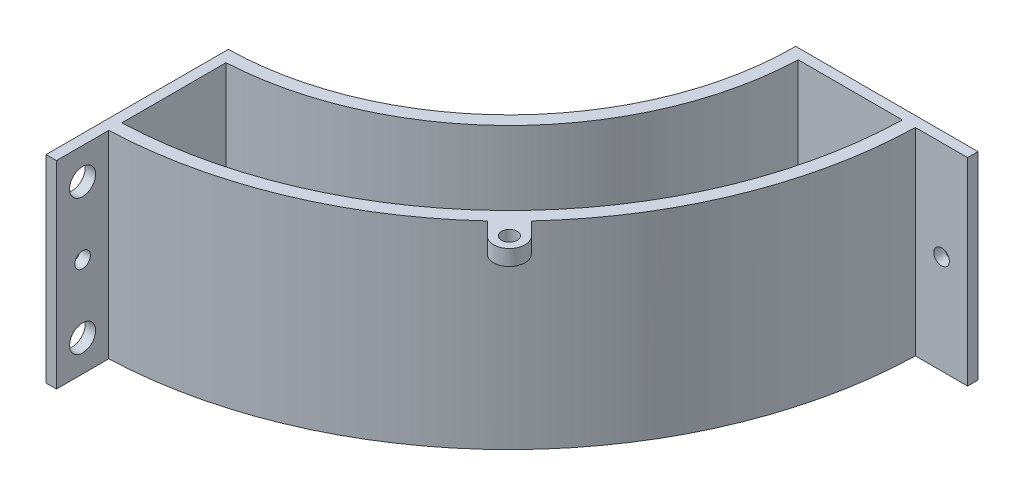
from build123d import *

# Parameters (mm, degrees)
EXTRUDE_1_DEPTH      = 36
EXTRUDE_START        = -2
EXTRUDE_2_DEPTH      = 2
SKETCH_3_R           = 2.5
SKETCH_3_R_2         = 1.5
CUT_EXTRUDE_1_DEPTH  = 126.677663072
EXTRUDE_3_DEPTH      = 2
EXTRUDE_3_DEPTH_BACK = 2
SKETCH_4_R           = 1.5
SKETCH_5_W           = 98.68516208
SKETCH_5_H           = 47.907231557
CUT_EXTRUDE_2_DEPTH  = 133.268193437
SKETCH_6_R           = 1.5
EXTRUDE_4_DEPTH      = 3


with BuildPart() as part:
    # 草图1 → 凸台-拉伸1 (new body)
    with BuildSketch(Plane(origin=(0, 0, 0), x_dir=(1, 0, 0), z_dir=(0, 1, 0))):
        with BuildLine():
            Line((3, -79.943730211), (3, -89.993749756))
            Line((3, -89.993749756), (1, -89.993749756))
            Line((1, -89.993749756), (1, -54.990908339))
            ThreePointArc((1, -54.990908339), (55, 0), (1, 54.990908339))
            Line((1, 54.990908339), (1, 79.993749756))
            Line((1, 79.993749756), (1, 89.993749756))
            Line((1, 89.993749756), (3, 89.993749756))
            Line((3, 89.993749756), (3, 79.943730211))
            ThreePointArc((3, 79.943730211), (80, 0), (3, -79.943730211))
        make_face()
        with BuildLine():
            Line((3, 77.441913716), (3, 57.421685799))
            ThreePointArc((3, 57.421685799), (57.5, 0), (3, -57.421685799))
            Line((3, -57.421685799), (3, -77.441913716))
            ThreePointArc((3, -77.441913716), (77.5, 0), (3, 77.441913716))
        make_face(mode=Mode.SUBTRACT)
    extrude(amount=EXTRUDE_1_DEPTH)

    # 草图2 → 凸台-拉伸2 (add)
    with BuildSketch(Plane(origin=(0, 0, 0), x_dir=(1, 0, 0), z_dir=(0, 1, 0)).offset(EXTRUDE_START)):
        with BuildLine():
            Line((1, 89.993749756), (1, 54.990908339))
            ThreePointArc((1, 54.990908339), (55, 0), (1, -54.990908339))
            Line((1, -54.990908339), (1, -89.993749756))
            Line((1, -89.993749756), (3, -89.993749756))
            Line((3, -89.993749756), (3, -79.943730211))
            ThreePointArc((3, -79.943730211), (80, 0), (3, 79.943730211))
            Line((3, 79.943730211), (3, 89.993749756))
            Line((3, 89.993749756), (1, 89.993749756))
        make_face()
    extrude(amount=EXTRUDE_2_DEPTH)

    # 草图3 → 切除-拉伸1 (cut, through all)
    with BuildSketch(Plane(origin=(0, 0, 0), x_dir=(0, 0, -1), z_dir=(1, 0, 0))):
        with Locations((-84.968739983, 30)):
            Circle(SKETCH_3_R)
        with Locations((-84.968739983, 17)):
            Circle(SKETCH_3_R_2)
        with Locations((84.968739983, 17)):
            Circle(SKETCH_3_R_2)
        with Locations((84.968739983, 30)):
            Circle(SKETCH_3_R)
        with Locations((-84.968739983, 4)):
            Circle(SKETCH_3_R)
    extrude(amount=CUT_EXTRUDE_1_DEPTH, mode=Mode.SUBTRACT)

    # 草图4 → 凸台-拉伸3 (add, two sides: drawn at the far end of the back side and taken through both)
    with BuildSketch(Plane.XY.offset(-EXTRUDE_3_DEPTH_BACK)):
        Polygon((80, 36), (55, 36), (55, -2), (80, -2), (90, -2), (90, 36), align=None)
        with Locations((85, 17)):
            Circle(SKETCH_4_R, mode=Mode.SUBTRACT)
    extrude(amount=EXTRUDE_3_DEPTH + EXTRUDE_3_DEPTH_BACK)

    # 草图5 → 切除-拉伸2 (cut, through all)
    with BuildSketch(Plane.XY):
        with Locations((47.157910723, 20.571893337)):
            Rectangle(SKETCH_5_W, SKETCH_5_H)
    extrude(amount=-CUT_EXTRUDE_2_DEPTH, mode=Mode.SUBTRACT)

    # 草图6 → 凸台-拉伸4 (add)
    with BuildSketch(Plane(origin=(0, 36, 0), x_dir=(1, 0, 0), z_dir=(0, 1, 0))):
        with BuildLine():
            Line((58.650074089, -54.407433402), (54.407433402, -58.650074089))
            Line((54.407433402, -58.650074089), (56.882307136, -61.124947823))
            ThreePointArc((56.882307136, -61.124947823), (61.124947823, -61.124947823), (61.124947823, -56.882307136))
            Line((61.124947823, -56.882307136), (58.650074089, -54.407433402))
        make_face()
        with Locations((59.003627479, -59.003627479)):
            Circle(SKETCH_6_R, mode=Mode.SUBTRACT)
    extrude(amount=-EXTRUDE_4_DEPTH)


solid = part.part
